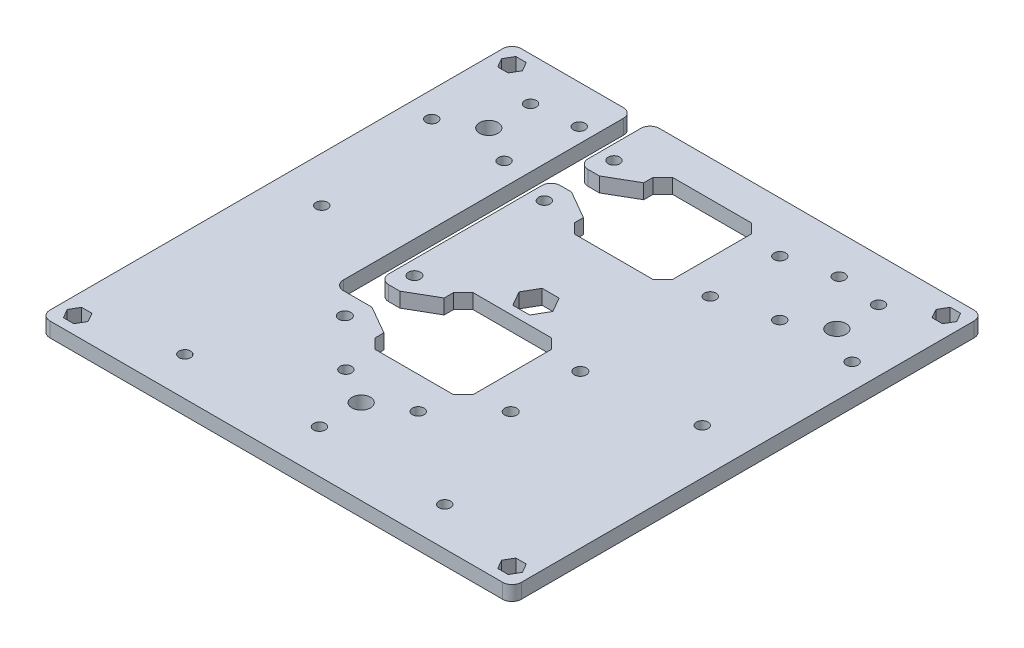
from build123d import *
from OCP.BRepFilletAPI import BRepFilletAPI_MakeChamfer

# Parameters (mm, degrees)
ESQUISSE1_W                  = 203.2
ESQUISSE1_H                  = 203.2
BOSS_EXTRU_1_DEPTH           = 6.35
ESQUISSE2_R                  = 4
ENL_V_MAT_EXTRU_1_DEPTH      = 144.824345992
ENL_V_MAT_EXTRU_2_DEPTH      = 144.824345992
ESQUISSE5_R                  = 2.5
ENL_V_MAT_EXTRU_4_DEPTH      = 144.824345992
ESQUISSE6_R                  = 2.5
ENL_V_MAT_EXTRU_5_DEPTH      = 144.824345992
ENL_V_MAT_EXTRU_6_DEPTH      = 144.824345992
ENL_V_MAT_EXTRU_6_DEPTH_BACK = 144.824345992
ESQUISSE8_R                  = 2.5
ENL_V_MAT_EXTRU_7_DEPTH      = 144.824345992
ENL_V_MAT_EXTRU_8_DEPTH      = 144.824345992
ESQUISSE10_R                 = 2.5
ENL_V_MAT_EXTRU_9_DEPTH      = 144.824345992
ENL_V_MAT_EXTRU_11_DEPTH     = 144.824345992
ENL_V_MAT_EXTRU_10_DEPTH     = 144.824345992
CONG_1_R                     = 4
ESQUISSE16_R                 = 2.6
ENL_V_MAT_EXTRU_12_DEPTH     = 144.824345992
CHANFREIN1_SIZE              = 7
CHANFREIN1_SIZE2             = 12.124355653
CHANFREIN2_SIZE              = 7
CHANFREIN2_SIZE2             = 12.124355653


with BuildPart() as part:
    # Esquisse1 → Boss.-Extru.1 (new body)
    with BuildSketch(Plane(origin=(0, 0, 0), x_dir=(1, 0, 0), z_dir=(0, 1, 0))):
        Rectangle(ESQUISSE1_W, ESQUISSE1_H)
    extrude(amount=BOSS_EXTRU_1_DEPTH)

    # Esquisse2 → Enlèv. mat.-Extru.1 (cut, through all)
    with BuildSketch(Plane(origin=(0, 6.35, 0), x_dir=(1, 0, 0), z_dir=(0, 1, 0))):
        with Locations(Location((-75, 65, 0), (0, 0, 270))):
            Circle(ESQUISSE2_R)
        with Locations(Location((75, 65, 0), (0, 0, 270))):
            Circle(ESQUISSE2_R)
        with Locations(Location((0, -65, 0), (0, 0, 270))):
            Circle(ESQUISSE2_R)
    extrude(amount=-ENL_V_MAT_EXTRU_1_DEPTH, mode=Mode.SUBTRACT)

    # Esquisse3 → Enlèv. mat.-Extru.2 (cut, through all)
    with BuildSketch(Plane(origin=(0, 6.35, 0), x_dir=(1, 0, 0), z_dir=(0, 1, 0))):
        Polygon((-16.978069991, 86.15), (-21.15, 81.978069991), (-21.15, 48.021930009), (-16.978069991, 43.85), (16.978069991, 43.85), (21.15, 48.021930009), (21.15, 81.978069991), (16.978069991, 86.15), align=None)
    extrude(amount=-ENL_V_MAT_EXTRU_2_DEPTH, mode=Mode.SUBTRACT)

    # Esquisse5 → Enlèv. mat.-Extru.4 (cut, through all)
    with BuildSketch(Plane(origin=(0, 6.35, 0), x_dir=(1, 0, 0), z_dir=(0, 1, 0))):
        with Locations(Location((-35.9, 49.85, 0), (0, 0, 270))):
            Circle(ESQUISSE5_R)
        with Locations(Location((-35.9, 79.85, 0), (0, 0, 270))):
            Circle(ESQUISSE5_R)
        with Locations(Location((35.6, 79.85, 0), (0, 0, 270))):
            Circle(ESQUISSE5_R)
        with Locations(Location((35.6, 49.85, 0), (0, 0, 270))):
            Circle(ESQUISSE5_R)
    extrude(amount=-ENL_V_MAT_EXTRU_4_DEPTH, mode=Mode.SUBTRACT)

    # Esquisse6 → Enlèv. mat.-Extru.5 (cut, through all)
    with BuildSketch(Plane(origin=(0, 6.35, 0), x_dir=(1, 0, 0), z_dir=(0, 1, 0))):
        with Locations(Location((93.6, -93.6, 0), (0, 0, 270))):
            Circle(ESQUISSE6_R)
        with Locations(Location((-93.6, -93.6, 0), (0, 0, 270))):
            Circle(ESQUISSE6_R)
        with Locations(Location((-93.6, 93.6, 0), (0, 0, 270))):
            Circle(ESQUISSE6_R)
        with Locations(Location((93.6, 93.6, 0), (0, 0, 270))):
            Circle(ESQUISSE6_R)
    extrude(amount=-ENL_V_MAT_EXTRU_5_DEPTH, mode=Mode.SUBTRACT)

    # Esquisse7 → Enlèv. mat.-Extru.6 (cut, two sides: drawn at the far end of the back side and taken through both)
    with BuildSketch(Plane(origin=(0, 6.35, 0), x_dir=(1, 0, 0), z_dir=(0, 1, 0)).offset(-ENL_V_MAT_EXTRU_6_DEPTH_BACK)):
        Polygon((-98.1033321, -93.6), (-95.85166605, -97.5), (-91.34833395, -97.5), (-89.0966679, -93.6), (-91.34833395, -89.7), (-95.85166605, -89.7), align=None)
        Polygon((89.0966679, -93.6), (91.34833395, -97.5), (95.85166605, -97.5), (98.1033321, -93.6), (95.85166605, -89.7), (91.34833395, -89.7), align=None)
        Polygon((89.0966679, 93.6), (91.34833395, 89.7), (95.85166605, 89.7), (98.1033321, 93.6), (95.85166605, 97.5), (91.34833395, 97.5), align=None)
        Polygon((-98.1033321, 93.6), (-95.85166605, 89.7), (-91.34833395, 89.7), (-89.0966679, 93.6), (-91.34833395, 97.5), (-95.85166605, 97.5), align=None)
    extrude(amount=ENL_V_MAT_EXTRU_6_DEPTH + ENL_V_MAT_EXTRU_6_DEPTH_BACK, mode=Mode.SUBTRACT)

    # Esquisse8 → Enlèv. mat.-Extru.7 (cut, through all)
    with BuildSketch(Plane(origin=(0, 6.35, 0), x_dir=(1, 0, 0), z_dir=(0, 1, 0))):
        with Locations(Location((90.588457268, 56, 0), (0, 0, 270))):
            Circle(ESQUISSE8_R)
        with Locations(Location((59.411542732, 56, 0), (0, 0, 270))):
            Circle(ESQUISSE8_R)
        with Locations(Location((75, 83, 0), (0, 0, 270))):
            Circle(ESQUISSE8_R)
        with Locations(Location((-90.589923123, 55.999154304, 0), (0, 0, 270))):
            Circle(ESQUISSE8_R)
        with Locations(Location((-75.001465855, 82.999154304, 0), (0, 0, 270))):
            Circle(ESQUISSE8_R)
        with Locations(Location((-59.413008586, 55.999154304, 0), (0, 0, 270))):
            Circle(ESQUISSE8_R)
        with Locations(Location((-15.588457268, -56, 0), (0, 0, 270))):
            Circle(ESQUISSE8_R)
        with Locations(Location((15.588457268, -56, 0), (0, 0, 270))):
            Circle(ESQUISSE8_R)
        with Locations(Location((0, -83, 0), (0, 0, 270))):
            Circle(ESQUISSE8_R)
    extrude(amount=-ENL_V_MAT_EXTRU_7_DEPTH, mode=Mode.SUBTRACT)

    # Esquisse9 → Enlèv. mat.-Extru.8 (cut, through all)
    with BuildSketch(Plane(origin=(0, 6.35, 0), x_dir=(1, 0, 0), z_dir=(0, 1, 0))):
        Polygon((-7.303480905, 10.325), (-3.651740453, 4), (3.651740453, 4), (7.303480905, 10.325), (3.651740453, 16.65), (-3.651740453, 16.65), align=None)
    extrude(amount=-ENL_V_MAT_EXTRU_8_DEPTH, mode=Mode.SUBTRACT)

    # Esquisse10 → Enlèv. mat.-Extru.9 (cut, through all)
    with BuildSketch(Plane.XZ):
        with Locations(Location((56, -85, 0), (0, 0, 270))):
            Circle(ESQUISSE10_R)
        with Locations(Location((82, 0, 0), (0, 0, 270))):
            Circle(ESQUISSE10_R)
        with Locations(Location((56, 85, 0), (0, 0, 270))):
            Circle(ESQUISSE10_R)
    enl_v_mat_extru_9 = extrude(amount=-ENL_V_MAT_EXTRU_9_DEPTH, mode=Mode.SUBTRACT)

    # Symétrie1: Enlèv. mat.-Extru.9 across plane
    add(enl_v_mat_extru_9.mirror(Plane(origin=(0, 0, 0), x_dir=(0, 0, 1), z_dir=(1, 0, 0))), mode=Mode.SUBTRACT)

    # Esquisse13 → Enlèv. mat.-Extru.11 (cut, through all)
    with BuildSketch(Plane(origin=(0, 6.35, 0), x_dir=(1, 0, 0), z_dir=(0, 1, 0))):
        Polygon((16.978069991, -42.150000003), (21.15, -37.978069994), (21.15, -4.021930012), (16.978069991, 0.149999997), (-16.978069991, 0.149999997), (-21.15, -4.021930012), (-21.15, -37.978069994), (-16.978069991, -42.150000003), align=None)
    extrude(amount=-ENL_V_MAT_EXTRU_11_DEPTH, mode=Mode.SUBTRACT)

    # Esquisse11 → Enlèv. mat.-Extru.10 (cut, through all)
    with BuildSketch(Plane(origin=(0, 6.35, 0), x_dir=(1, 0, 0), z_dir=(0, 1, 0))):
        Polygon((-21.15, 58.928069991), (-42.1, 58.928069991), (-42.1, -15.071930012), (-21.15, -15.071930012), (-21.15, -27.071930012), (-49.6, -27.071930012), (-49.6, -15.071930012), (-49.6, 58.928069991), (-49.6, 101.6), (-42.1, 101.6), (-42.1, 70.928069991), (-21.15, 70.928069991), align=None)
    extrude(amount=-ENL_V_MAT_EXTRU_10_DEPTH, mode=Mode.SUBTRACT)

    # Congé1
    cong_1_edges = [part.edges().sort_by_distance(p)[0] for p in [
        (-42.1, 3.175, -58.928069991),
        (-42.1, 3.175, 15.071930012),
        (-49.6, 3.175, 27.071930012),
        (-49.6, 3.175, -101.6),
        (-42.1, 3.175, -101.6),
        (-42.1, 3.175, -70.928069991),
        (101.6, 3.175, 101.6),
        (-101.6, 3.175, 101.6),
        (-101.6, 3.175, -101.6),
        (101.6, 3.175, -101.6),
    ]]
    fillet(cong_1_edges, radius=CONG_1_R)

    # Esquisse16 → Enlèv. mat.-Extru.12 (cut, through all)
    with BuildSketch(Plane(origin=(0, 6.35, 0), x_dir=(1, 0, 0), z_dir=(0, 1, 0))):
        with Locations(Location((35.6, -36.15, 0), (0, 0, 270))):
            Circle(ESQUISSE16_R)
        with Locations(Location((35.6, -6.15, 0), (0, 0, 270))):
            Circle(ESQUISSE16_R)
        with Locations(Location((-35.9, -6.15, 0), (0, 0, 270))):
            Circle(ESQUISSE16_R)
        with Locations(Location((-35.9, -36.15, 0), (0, 0, 270))):
            Circle(ESQUISSE16_R)
    extrude(amount=-ENL_V_MAT_EXTRU_12_DEPTH, mode=Mode.SUBTRACT)

    # Chanfrein1: one chamfer whose edges measure the first distance from different faces: ONE call of the kernel's chamfer builder (chamfer() names one face for all edges)
    chanfrein1_edges_1 = [part.edges().sort_by_distance(p)[0] for p in [
        (-21.15, 3.175, -70.928069991),
    ]]
    chanfrein1_side_1 = [part.faces().sort_by_distance(p)[0] for p in [
        (-21.15, 3.175, -76.453069991),
    ]]
    chanfrein1_edges_2 = [part.edges().sort_by_distance(p)[0] for p in [
        (-21.15, 3.175, -58.928069991),
    ]]
    chanfrein1_side_2 = [part.faces().sort_by_distance(p)[0] for p in [
        (-21.15, 3.175, -53.475),
    ]]
    chanfrein1 = BRepFilletAPI_MakeChamfer(part.part.solid().wrapped)
    for e in chanfrein1_edges_1:
        chanfrein1.Add(CHANFREIN1_SIZE, CHANFREIN1_SIZE2, e.wrapped, chanfrein1_side_1[0].wrapped)  # the first distance lies on this face
    for e in chanfrein1_edges_2:
        chanfrein1.Add(CHANFREIN1_SIZE, CHANFREIN1_SIZE2, e.wrapped, chanfrein1_side_2[0].wrapped)  # the first distance lies on this face
    add(Compound.cast(chanfrein1.Shape()), mode=Mode.REPLACE)

    # Chanfrein2: one chamfer whose edges measure the first distance from different faces: ONE call of the kernel's chamfer builder (chamfer() names one face for all edges)
    chanfrein2_edges_1 = [part.edges().sort_by_distance(p)[0] for p in [
        (-21.15, 3.175, 15.071930012),
    ]]
    chanfrein2_side_1 = [part.faces().sort_by_distance(p)[0] for p in [
        (-21.15, 3.175, 9.546930012),
    ]]
    chanfrein2_edges_2 = [part.edges().sort_by_distance(p)[0] for p in [
        (-21.15, 3.175, 27.071930012),
    ]]
    chanfrein2_side_2 = [part.faces().sort_by_distance(p)[0] for p in [
        (-21.15, 3.175, 32.525000003),
    ]]
    chanfrein2 = BRepFilletAPI_MakeChamfer(part.part.solid().wrapped)
    for e in chanfrein2_edges_1:
        chanfrein2.Add(CHANFREIN2_SIZE, CHANFREIN2_SIZE2, e.wrapped, chanfrein2_side_1[0].wrapped)  # the first distance lies on this face
    for e in chanfrein2_edges_2:
        chanfrein2.Add(CHANFREIN2_SIZE, CHANFREIN2_SIZE2, e.wrapped, chanfrein2_side_2[0].wrapped)  # the first distance lies on this face
    add(Compound.cast(chanfrein2.Shape()), mode=Mode.REPLACE)


solid = part.part
